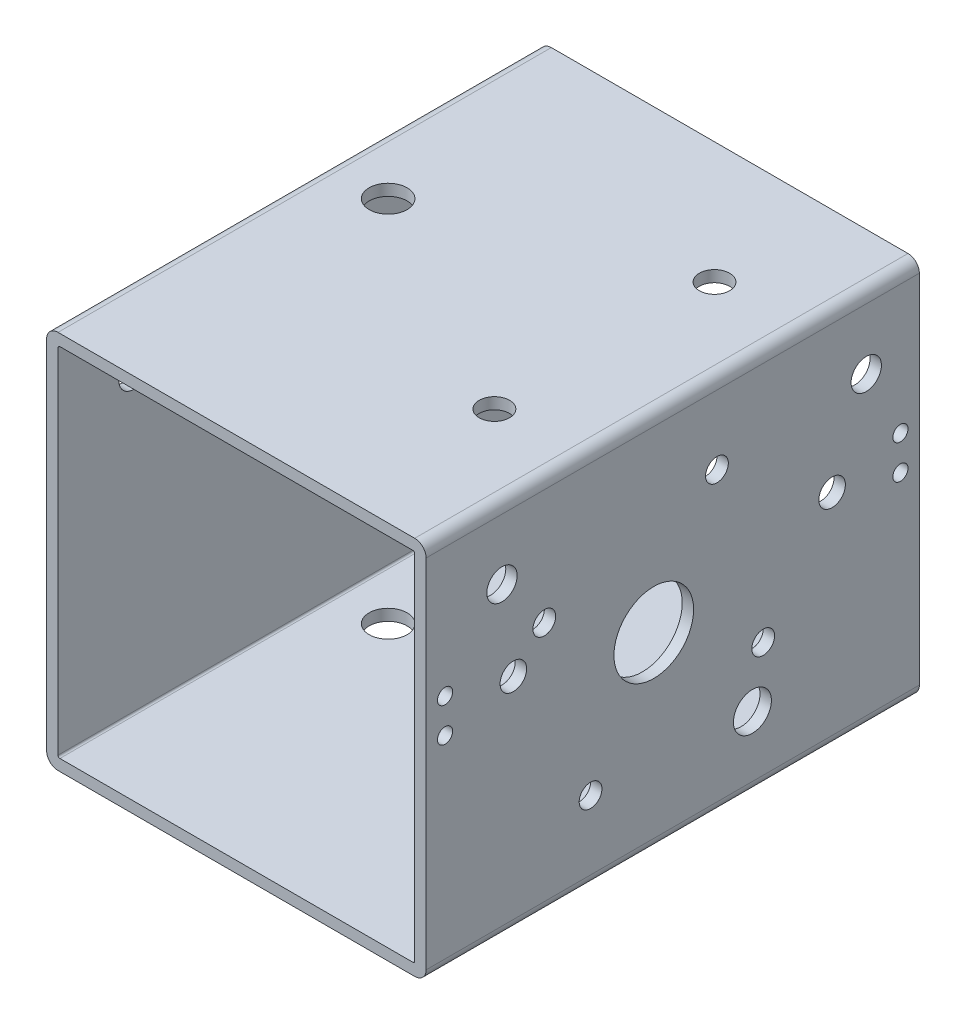
from build123d import *

# Parameters (mm, degrees)
SKETCH1_W                      = 100
SKETCH1_H                      = 100
SKETCH1_W_2                    = 94
SKETCH1_H_2                    = 94
EXTRUDE_THIN1_DEPTH            = 130
FILLET1_R                      = 0.5
FILLET2_R                      = 3
F_8_0_8_DIAMETER_HOLE2_D       = 8
F_8_0_8_DIAMETER_HOLE3_D       = 8
F_10_0_10_DIAMETER_HOLE1_D     = 10
F_10_0_10_DIAMETER_HOLE2_D     = 10
M8X1_25_TAPPED_HOLE1_D         = 6.8
M8X1_25_TAPPED_HOLE1_DEPTH     = 3
M8X1_25_TAPPED_HOLE2_D         = 6.8
M8X1_25_TAPPED_HOLE2_DEPTH     = 3
F_21_0_21_DIAMETER_HOLE1_D     = 21
F_21_0_21_DIAMETER_HOLE1_DEPTH = 3
F_6_0_6_DIAMETER_HOLE1_D       = 6
F_6_0_6_DIAMETER_HOLE1_DEPTH   = 3
CUT_EXTRUDE1_REACH             = 173.464
SKETCH27_R                     = 2
SKETCH27_R_2                   = 3.5


with BuildPart() as part:
    # Sketch1 → Extrude-Thin1 (new body)
    with BuildSketch(Plane.XY):
        Rectangle(SKETCH1_W, SKETCH1_H)
        Rectangle(SKETCH1_W_2, SKETCH1_H_2, mode=Mode.SUBTRACT)
    extrude(amount=EXTRUDE_THIN1_DEPTH)

    # Fillet1
    fillet1_edges = [part.edges().sort_by_distance(p)[0] for p in [
        (47, -47, 65),
        (47, 47, 65),
        (-47, 47, 65),
        (-47, -47, 65),
    ]]
    fillet(fillet1_edges, radius=FILLET1_R)

    # Fillet2
    fillet2_edges = [part.edges().sort_by_distance(p)[0] for p in [
        (50, -50, 65),
        (-50, -50, 65),
        (-50, 50, 65),
        (50, 50, 65),
    ]]
    fillet(fillet2_edges, radius=FILLET2_R)

    # Ø8.0 (8) Diameter Hole2 (through all)
    with Locations(Plane(origin=(0, 50, 0), x_dir=(1, 0, 0), z_dir=(0, 1, 0))):
        with Locations((28, -32), (28, -90)):
            Hole(F_8_0_8_DIAMETER_HOLE2_D / 2)

    # Ø8.0 (8) Diameter Hole3 (through all)
    with Locations(Plane(origin=(50, 0, 0), x_dir=(0, 0, -1), z_dir=(1, 0, 0))):
        with Locations((-14, 31), (-110, 31)):
            Hole(F_8_0_8_DIAMETER_HOLE3_D / 2)

    # Ø10.0 (10) Diameter Hole1 (through all)
    with Locations(Plane(origin=(0, 50, 0), x_dir=(1, 0, 0), z_dir=(0, 1, 0))):
        with Locations((-34, -56)):
            Hole(F_10_0_10_DIAMETER_HOLE1_D / 2)

    # Ø10.0 (10) Diameter Hole2 (through all)
    with Locations(Plane(origin=(50, 0, 0), x_dir=(0, 0, -1), z_dir=(1, 0, 0))):
        with Locations((-44, -31)):
            Hole(F_10_0_10_DIAMETER_HOLE2_D / 2)

    # M8x1.25 Tapped Hole1
    with Locations(Plane.ZY.offset(50)):
        with Locations((56, -15), (56, 35)):
            Hole(M8X1_25_TAPPED_HOLE1_D / 2, depth=M8X1_25_TAPPED_HOLE1_DEPTH)

    # M8x1.25 Tapped Hole2
    with Locations(Plane(origin=(0, -50, 0), x_dir=(-1, 0, 0), z_dir=(0, -1, 0))):
        with Locations((20, -44), (-35, -44)):
            Hole(M8X1_25_TAPPED_HOLE2_D / 2, depth=M8X1_25_TAPPED_HOLE2_DEPTH)

    # Ø21.0 (21) Diameter Hole1
    with Locations(Plane(origin=(50, 0, 0), x_dir=(0, 0, -1), z_dir=(1, 0, 0))):
        with Locations((-70, 0)):
            Hole(F_21_0_21_DIAMETER_HOLE1_D / 2, depth=F_21_0_21_DIAMETER_HOLE1_DEPTH)

    # Ø6.0 (6) Diameter Hole1
    with Locations(Plane(origin=(50, 0, 0), x_dir=(0, 0, -1), z_dir=(1, 0, 0))):
        with Locations((-41.157258279, -16.652364697), (-53.347635303, 28.842741721), (-98.842741721, 16.652364697), (-86.652364697, -28.842741721)):
            Hole(F_6_0_6_DIAMETER_HOLE1_D / 2, depth=F_6_0_6_DIAMETER_HOLE1_DEPTH)

    # Sketch27 → Cut-Extrude1 (cut, up to next)
    with BuildSketch(Plane(origin=(50, 0, 0), x_dir=(0, 0, -1), z_dir=(1, 0, 0)), mode=Mode.PRIVATE) as cut_extrude1_sk1:
        with Locations(Location((-5, 13, 0), (0, 0, 90))):
            Circle(SKETCH27_R)
    cut_extrude1_tool1 = extrude(cut_extrude1_sk1.sketch, amount=-CUT_EXTRUDE1_REACH, mode=Mode.PRIVATE) & part.part
    # Sketch27 → Cut-Extrude1 (cut, up to next)
    with BuildSketch(Plane(origin=(50, 0, 0), x_dir=(0, 0, -1), z_dir=(1, 0, 0)), mode=Mode.PRIVATE) as cut_extrude1_sk2:
        with Locations(Location((-5, 4, 0), (0, 0, 90))):
            Circle(SKETCH27_R)
    cut_extrude1_tool2 = extrude(cut_extrude1_sk2.sketch, amount=-CUT_EXTRUDE1_REACH, mode=Mode.PRIVATE) & part.part
    # Sketch27 → Cut-Extrude1 (cut, up to next)
    with BuildSketch(Plane(origin=(50, 0, 0), x_dir=(0, 0, -1), z_dir=(1, 0, 0)), mode=Mode.PRIVATE) as cut_extrude1_sk3:
        with Locations(Location((-23, 8.5, 0), (0, 0, 90))):
            Circle(SKETCH27_R_2)
    cut_extrude1_tool3 = extrude(cut_extrude1_sk3.sketch, amount=-CUT_EXTRUDE1_REACH, mode=Mode.PRIVATE) & part.part
    # Sketch27 → Cut-Extrude1 (cut, up to next)
    with BuildSketch(Plane(origin=(50, 0, 0), x_dir=(0, 0, -1), z_dir=(1, 0, 0)), mode=Mode.PRIVATE) as cut_extrude1_sk4:
        with Locations(Location((-107, 8.5, 0), (0, 0, 270))):
            Circle(SKETCH27_R_2)
    cut_extrude1_tool4 = extrude(cut_extrude1_sk4.sketch, amount=-CUT_EXTRUDE1_REACH, mode=Mode.PRIVATE) & part.part
    # Sketch27 → Cut-Extrude1 (cut, up to next)
    with BuildSketch(Plane(origin=(50, 0, 0), x_dir=(0, 0, -1), z_dir=(1, 0, 0)), mode=Mode.PRIVATE) as cut_extrude1_sk5:
        with Locations(Location((-125, 4, 0), (0, 0, 270))):
            Circle(SKETCH27_R)
    cut_extrude1_tool5 = extrude(cut_extrude1_sk5.sketch, amount=-CUT_EXTRUDE1_REACH, mode=Mode.PRIVATE) & part.part
    # Sketch27 → Cut-Extrude1 (cut, up to next)
    with BuildSketch(Plane(origin=(50, 0, 0), x_dir=(0, 0, -1), z_dir=(1, 0, 0)), mode=Mode.PRIVATE) as cut_extrude1_sk6:
        with Locations(Location((-125, 13, 0), (0, 0, 270))):
            Circle(SKETCH27_R)
    cut_extrude1_tool6 = extrude(cut_extrude1_sk6.sketch, amount=-CUT_EXTRUDE1_REACH, mode=Mode.PRIVATE) & part.part
    add(cut_extrude1_tool1.solids().sort_by_distance((50, 13, 5))[0], mode=Mode.SUBTRACT)
    add(cut_extrude1_tool2.solids().sort_by_distance((50, 4, 5))[0], mode=Mode.SUBTRACT)
    add(cut_extrude1_tool3.solids().sort_by_distance((50, 8.5, 23))[0], mode=Mode.SUBTRACT)
    add(cut_extrude1_tool4.solids().sort_by_distance((50, 8.5, 107))[0], mode=Mode.SUBTRACT)
    add(cut_extrude1_tool5.solids().sort_by_distance((50, 4, 125))[0], mode=Mode.SUBTRACT)
    add(cut_extrude1_tool6.solids().sort_by_distance((50, 13, 125))[0], mode=Mode.SUBTRACT)


solid = part.part
